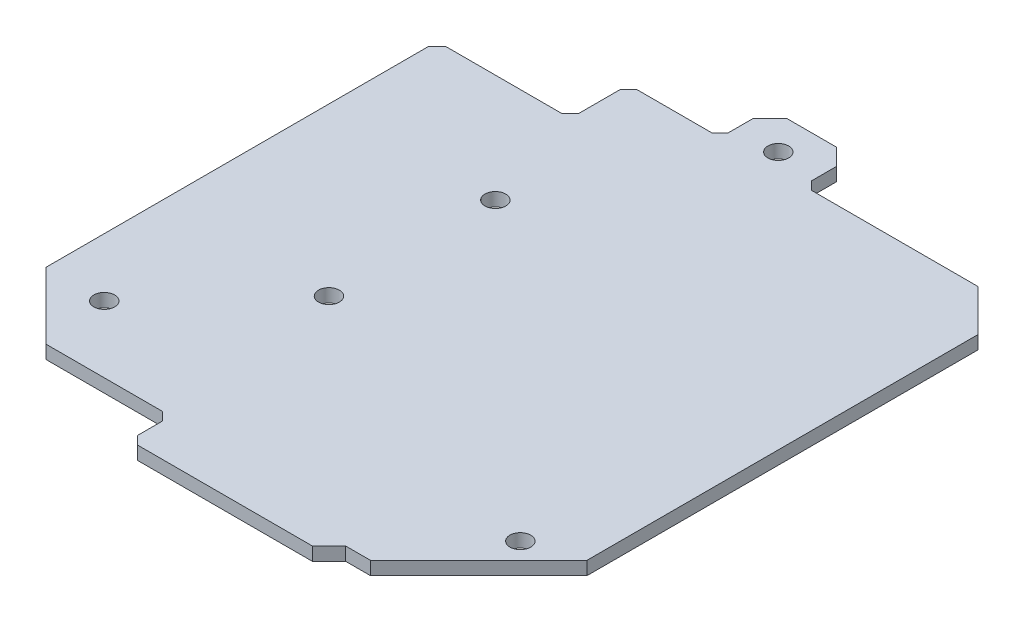
from build123d import *

# Parameters (mm, degrees)
SKETCH_1_R      = 1.25
EXTRUDE_1_DEPTH = 1.6


with BuildPart() as part:
    # Эскиз1 → Бобышка-Вытянуть1 (new body)
    with BuildSketch(Plane(origin=(0, 0, 0), x_dir=(1, 0, 0), z_dir=(0, 1, 0))):
        Polygon((-32, -24), (-32, 22), (-31, 23), (-17, 23), (-16, 24), (-16, 29), (-15, 30), (-6, 30), (-5, 31), (-5, 34), (-3, 36), (3, 36), (5, 34), (5, 31), (6, 30), (26, 30), (31, 25), (31, -22), (18, -35), (15, -35), (13, -37), (-8, -37), (-9, -36), (-9, -33), (-10, -32), (-24, -32), align=None)
        with Locations(Location((-25, -24, 0), (0, 0, 270))):
            Circle(SKETCH_1_R, mode=Mode.SUBTRACT)
        with Locations(Location((25, -24, 0), (0, 0, 90))):
            Circle(SKETCH_1_R, mode=Mode.SUBTRACT)
        with Locations(Location((0, 32, 0), (0, 0, 270))):
            Circle(SKETCH_1_R, mode=Mode.SUBTRACT)
        with Locations(Location((-12, -10, 0), (0, 0, 270))):
            Circle(SKETCH_1_R, mode=Mode.SUBTRACT)
        with Locations(Location((-12, 10, 0), (0, 0, 90))):
            Circle(SKETCH_1_R, mode=Mode.SUBTRACT)
    extrude(amount=EXTRUDE_1_DEPTH)


solid = part.part
